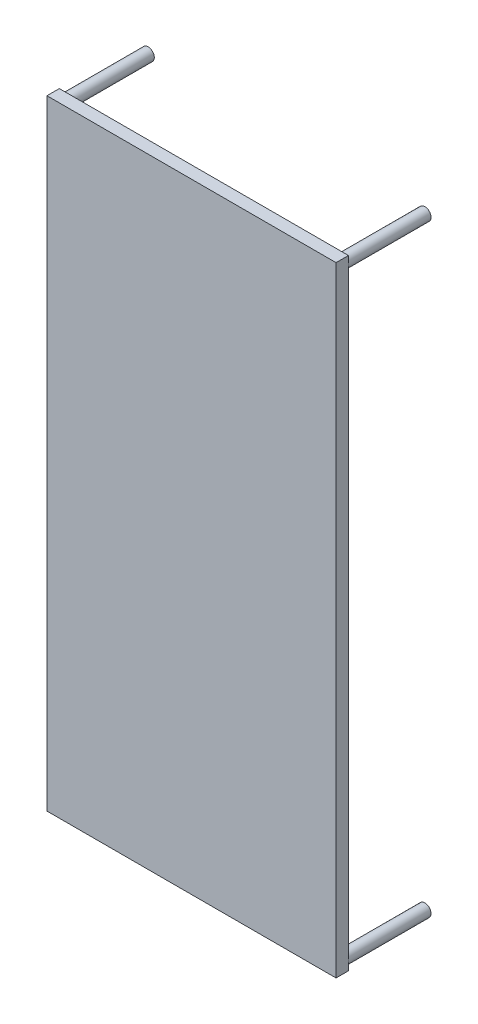
from build123d import *

# Parameters (mm, degrees)
ESBO_O1_R                  = 1.5
RESSALTO_EXTRUS_O1_DEPTH   = 20
RESSALTO_EXTRUS_O1_2_DEPTH = 20
RESSALTO_EXTRUS_O1_3_DEPTH = 20
RESSALTO_EXTRUS_O1_4_DEPTH = 20
ESBO_O2_W                  = 70
ESBO_O2_H                  = 150
RESSALTO_EXTRUS_O2_DEPTH   = 3


with BuildPart() as part:
    # Esboço1 → Ressalto-extrusão1 (new body)
    with BuildSketch(Plane.XY):
        with Locations((33.5, 148)):
            Circle(ESBO_O1_R)
    extrude(amount=RESSALTO_EXTRUS_O1_DEPTH)



with BuildPart() as body_2:
    # Esboço1 → Ressalto-extrus_o1 2 (new body)
    with BuildSketch(Plane.XY):
        with Locations((-33.5, 148)):
            Circle(ESBO_O1_R)
    extrude(amount=RESSALTO_EXTRUS_O1_2_DEPTH)


with BuildPart() as body_3:
    # Esboço1 → Ressalto-extrus_o1 3 (new body)
    with BuildSketch(Plane.XY):
        with Locations((33.5, 2)):
            Circle(ESBO_O1_R)
    extrude(amount=RESSALTO_EXTRUS_O1_3_DEPTH)


with BuildPart() as body_4:
    # Esboço1 → Ressalto-extrus_o1 4 (new body)
    with BuildSketch(Plane.XY):
        with Locations((-33.5, 2)):
            Circle(ESBO_O1_R)
    extrude(amount=RESSALTO_EXTRUS_O1_4_DEPTH)


with BuildPart() as part_1:
    add(part.part)

    add(body_2.part)  # Ressalto-extrusão2 merges body 2

    add(body_3.part)  # Ressalto-extrusão2 merges body 3

    add(body_4.part)  # Ressalto-extrusão2 merges body 4
    # Esboço2 → Ressalto-extrusão2 (add)
    with BuildSketch(Plane.XY.offset(20)):
        with Locations((0, 75)):
            Rectangle(ESBO_O2_W, ESBO_O2_H)
    extrude(amount=RESSALTO_EXTRUS_O2_DEPTH)


solid = part_1.part
